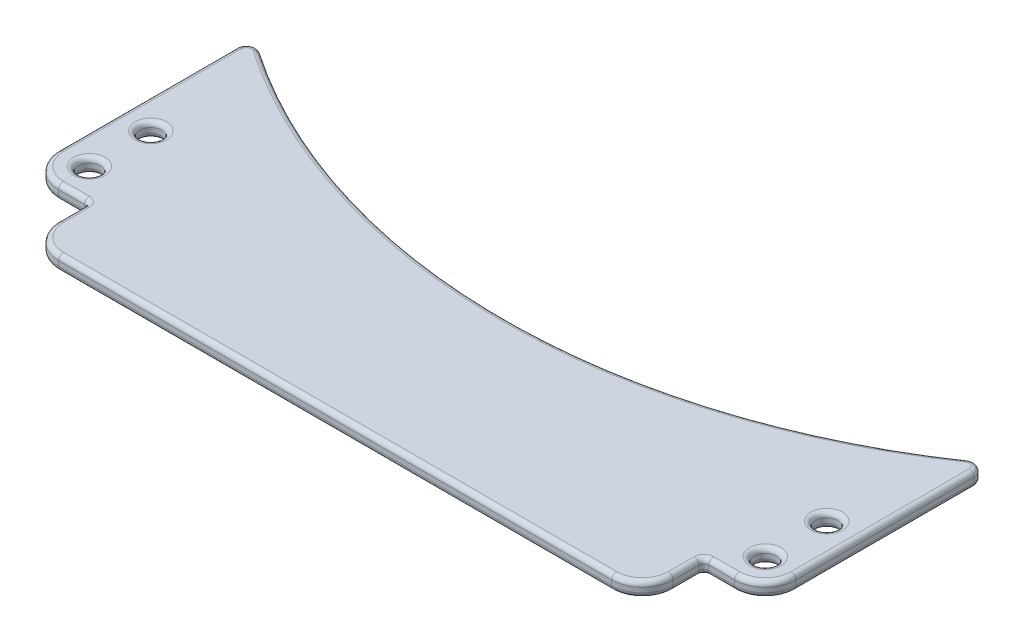
from build123d import *

# Parameters (mm, degrees)
SKETCH1_R           = 2.25
BOSS_EXTRUDE1_DEPTH = 3
FILLET5_R           = 6.35
FILLET6_R           = 2
FILLET7_R           = 1


with BuildPart() as part:
    # Sketch1 → Boss-Extrude1 (new body)
    with BuildSketch(Plane(origin=(0, 0, 0), x_dir=(1, 0, 0), z_dir=(0, 1, 0))):
        with BuildLine():
            Line((-63.5, -165), (63.5, -165))
            Line((63.5, -165), (63.5, -152.3))
            Line((63.5, -152.3), (76.2, -152.3))
            Line((76.2, -152.3), (76.2, -105.325970207))
            ThreePointArc((76.2, -105.325970207), (0, -130), (-76.2, -105.325970207))
            Line((-76.2, -105.325970207), (-76.2, -152.3))
            Line((-76.2, -152.3), (-63.5, -152.3))
            Line((-63.5, -152.3), (-63.5, -165))
        make_face()
        with Locations(Location((-69.85, -145.95, 0), (0, 0, 270))):
            Circle(SKETCH1_R, mode=Mode.SUBTRACT)
        with Locations(Location((-69.85, -133.25, 0), (0, 0, 270))):
            Circle(SKETCH1_R, mode=Mode.SUBTRACT)
        with Locations(Location((69.85, -133.25, 0), (0, 0, 270))):
            Circle(SKETCH1_R, mode=Mode.SUBTRACT)
        with Locations(Location((69.85, -145.95, 0), (0, 0, 270))):
            Circle(SKETCH1_R, mode=Mode.SUBTRACT)
    extrude(amount=BOSS_EXTRUDE1_DEPTH)

    # Fillet5
    fillet5_edges = [part.edges().sort_by_distance(p)[0] for p in [
        (76.2, 1.5, 152.3),
        (63.5, 1.5, 165),
        (-63.5, 1.5, 165),
        (-76.2, 1.5, 152.3),
    ]]
    fillet(fillet5_edges, radius=FILLET5_R)

    # Fillet6
    fillet6_edges = [part.edges().sort_by_distance(p)[0] for p in [
        (76.2, 1.5, 105.325970207),
        (-76.2, 1.5, 105.325970207),
    ]]
    fillet(fillet6_edges, radius=FILLET6_R)

    # Fillet7
    fillet7_edges = [part.edges().sort_by_distance(p)[0] for p in [
        (69.85, 3, 131),
        (69.85, 0, 143.7),
        (-69.85, 3, 131),
        (66.675, 0, 152.3),
        (-66.675, 0, 152.3),
        (-69.85, 0, 143.7),
        (-69.85, 0, 131),
        (-69.85, 3, 143.7),
        (69.85, 0, 131),
        (63.5, 1.5, 152.3),
        (-63.5, 1.5, 152.3),
        (-66.675, 3, 152.3),
        (76.2, 0, 127.560620817),
        (63.5, 0, 155.475),
        (0, 0, 165),
        (-63.5, 0, 155.475),
        (-76.2, 0, 127.560620817),
        (74.340128061, 0, 150.440128061),
        (61.640128061, 0, 163.140128061),
        (-61.640128061, 0, 163.140128061),
        (-74.340128061, 0, 150.440128061),
        (-76.2, 3, 127.560620817),
        (-63.5, 3, 155.475),
        (0, 3, 165),
        (63.5, 3, 155.475),
        (76.2, 3, 127.560620817),
        (74.340128061, 3, 150.440128061),
        (61.640128061, 3, 163.140128061),
        (-61.640128061, 3, 163.140128061),
        (-74.340128061, 3, 150.440128061),
        (66.675, 3, 152.3),
        (0, 0, 130),
        (0, 3, 130),
        (69.85, 3, 143.7),
        (-75.1358192, 0, 107.403688969),
        (75.1358192, 0, 107.403688969),
        (-75.1358192, 3, 107.403688969),
        (75.1358192, 3, 107.403688969),
    ]]
    fillet(fillet7_edges, radius=FILLET7_R)


solid = part.part
